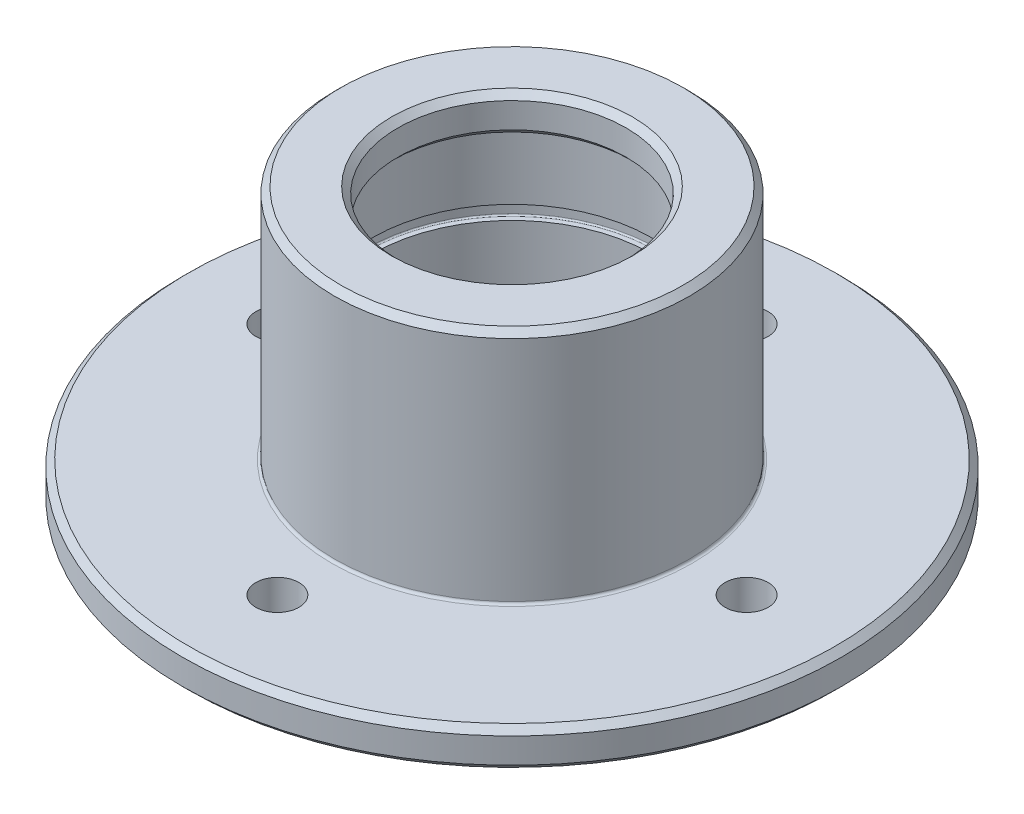
from build123d import *

# Parameters (mm, degrees)
M3_CLEARANCE_HOLE1_D = 3.4
FILLET1_R            = 0.2
FILLET2_R            = 0.2
CHAMFER1_SIZE        = 0.5


with BuildPart() as part:
    # Sketch1 → Revolve1 (revolve)
    with BuildSketch(Plane.XY, mode=Mode.PRIVATE) as revolve1_sk:
        Polygon((11, -3), (11, 15.65), (9, 15.65), (9, 18.65), (14, 18.65), (14, 0), (26, 0), (26, -3), align=None)
    revolve(revolve1_sk.sketch.rotate(Axis((0, 17.954019247, 0), (0, -1, 0)), 90), axis=Axis((0, 17.954019247, 0), (0, -1, 0)))

    # Sketch4 → Groove for BS 3673 P4 - B022M, Internal Circlip1 (revolve, cut)
    with BuildSketch(Plane(origin=(0, 17.954019247, 0), x_dir=(0, 0, 1), z_dir=(-1, 0, 0))):
        with BuildLine():
            Line((11.39, -9.404019247), (9.9, -9.404019247))
            Line((9.9, -9.404019247), (9.9, -8.304019247))
            Line((9.9, -8.304019247), (11.39, -8.304019247))
            ThreePointArc((11.39, -8.304019247), (11.467781746, -8.336237501), (11.5, -8.414019247))
            Line((11.5, -8.414019247), (11.5, -9.294019247))
            ThreePointArc((11.5, -9.294019247), (11.467781746, -9.371800993), (11.39, -9.404019247))
        make_face()
    revolve(axis=Axis((0, -32.045980753, 0), (0, 1, 0)), mode=Mode.SUBTRACT)

    # M3 Clearance Hole1 (through all)
    with Locations(Plane(origin=(0, 0, 0), x_dir=(1, 0, 0), z_dir=(0, 1, 0))):
        with Locations((0, 18.5), (18.5, 0), (0, -18.5), (-18.5, 0)):
            Hole(M3_CLEARANCE_HOLE1_D / 2)

    # Fillet1
    fillet1_edges = [part.edges().sort_by_distance(p)[0] for p in [
        (0, 15.65, -11),
    ]]
    fillet(fillet1_edges, radius=FILLET1_R)

    # Fillet2
    fillet2_edges = [part.edges().sort_by_distance(p)[0] for p in [
        (0, 0, -14),
    ]]
    fillet(fillet2_edges, radius=FILLET2_R)

    # Chamfer1
    chamfer1_edges = [part.edges().sort_by_distance(p)[0] for p in [
        (0, 15.65, -9),
        (0, 18.65, -9),
        (0, 18.65, -14),
        (0, 0, -26),
        (0, -3, -26),
        (0, -3, -11),
    ]]
    chamfer(chamfer1_edges, length=CHAMFER1_SIZE)


solid = part.part
